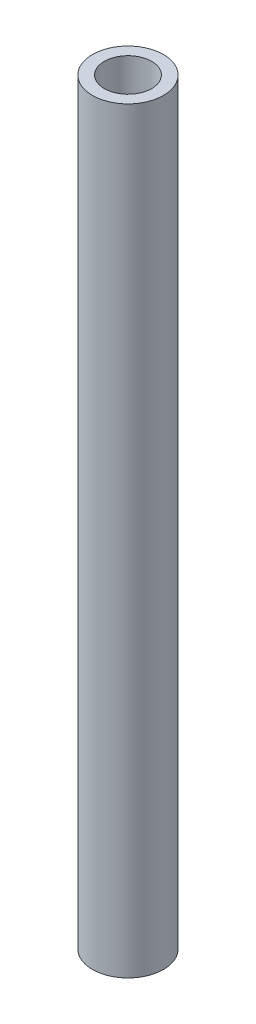
from build123d import *

# Parameters (mm, degrees)
SKETCH1_R           = 2.38125
SKETCH1_R_2         = 1.5875
BOSS_EXTRUDE1_DEPTH = 50.8


with BuildPart() as part:
    # Sketch1 → Boss-Extrude1 (new body)
    with BuildSketch(Plane(origin=(0, 0, 0), x_dir=(1, 0, 0), z_dir=(0, 1, 0))):
        with Locations(Location((0, 0, 0), (0, 0, 270))):
            Circle(SKETCH1_R)
        with Locations(Location((0, 0, 0), (0, 0, 270))):
            Circle(SKETCH1_R_2, mode=Mode.SUBTRACT)
    extrude(amount=BOSS_EXTRUDE1_DEPTH)


solid = part.part
